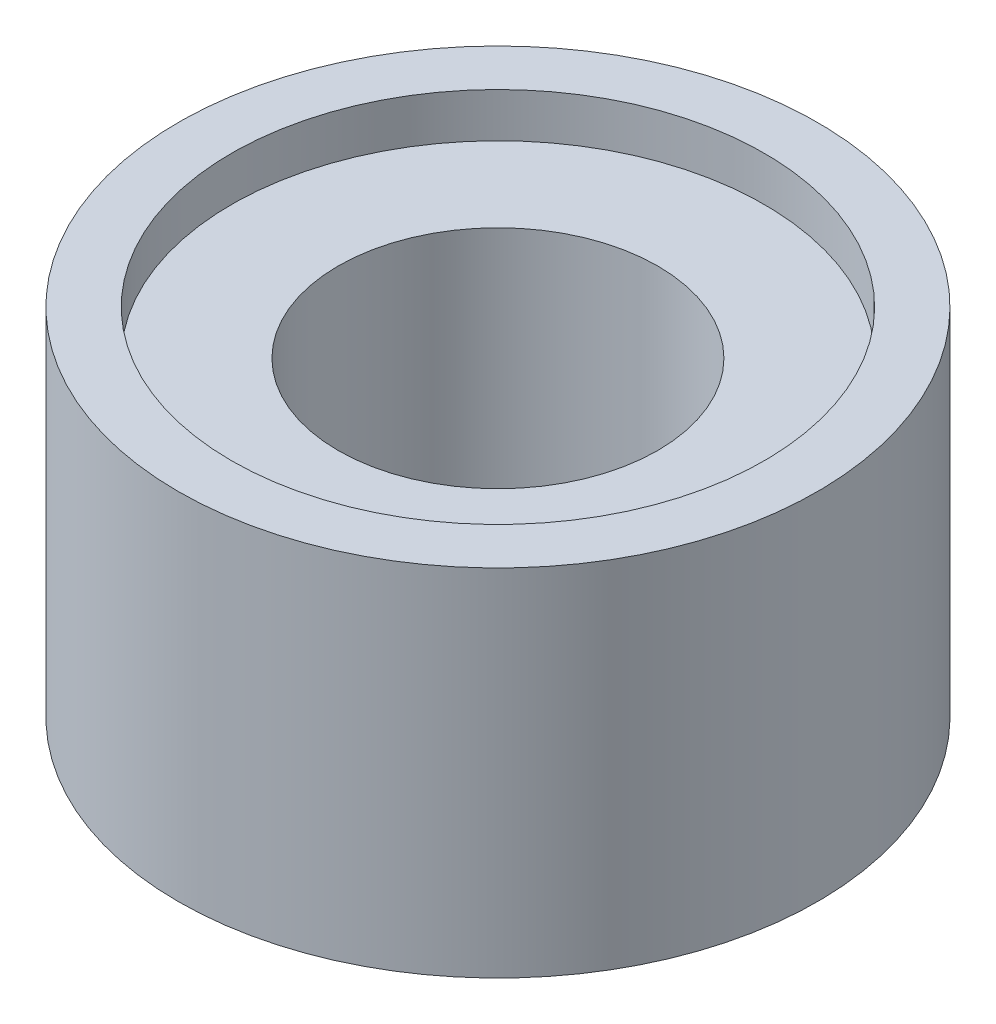
from build123d import *

# Parameters (mm, degrees)
SKETCH1_R           = 15
SKETCH1_R_2         = 9
BOSS_EXTRUDE1_DEPTH = 7.5
SKETCH3_R           = 18
SKETCH3_R_2         = 15
BOSS_EXTRUDE2_DEPTH = 10


with BuildPart() as part:
    # Sketch1 → Boss-Extrude1 (new, symmetric)
    with BuildSketch(Plane(origin=(0, 0, 0), x_dir=(1, 0, 0), z_dir=(0, 1, 0))):
        with Locations(Location((0, 0, 0), (0, 0, 270))):
            Circle(SKETCH1_R)
        with Locations(Location((0, 0, 0), (0, 0, 270))):
            Circle(SKETCH1_R_2, mode=Mode.SUBTRACT)
    extrude(amount=BOSS_EXTRUDE1_DEPTH, both=True)

    # Sketch3 → Boss-Extrude2 (add, symmetric)
    with BuildSketch(Plane(origin=(0, 0, 0), x_dir=(1, 0, 0), z_dir=(0, 1, 0))):
        with Locations(Location((0, 0, 0), (0, 0, 270))):
            Circle(SKETCH3_R)
        with Locations(Location((0, 0, 0), (0, 0, 270))):
            Circle(SKETCH3_R_2, mode=Mode.SUBTRACT)
    extrude(amount=BOSS_EXTRUDE2_DEPTH, both=True)


solid = part.part
